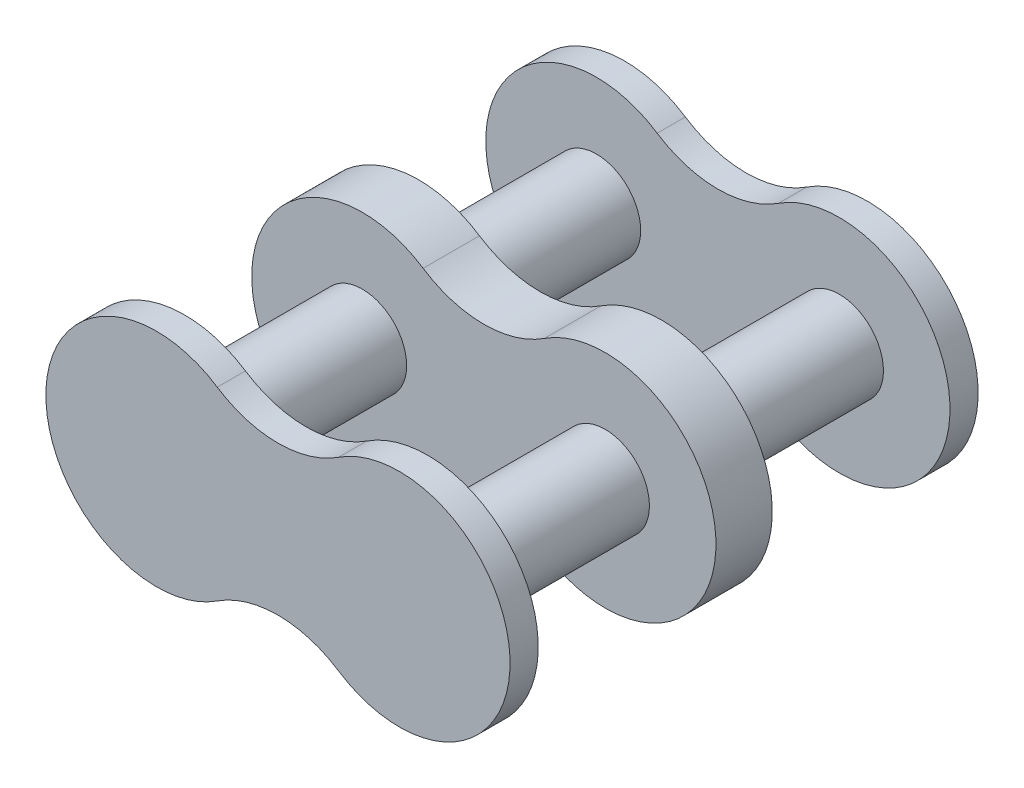
from build123d import *

# Parameters (mm, degrees)
BOSS_EXTRUDE1_DEPTH = 0.7366
BOSS_EXTRUDE2_START = 5.3848
BOSS_EXTRUDE2_DEPTH = 0.7366
SKETCH2_R           = 1.1557
BOSS_EXTRUDE3_DEPTH = 4.6482
BOSS_EXTRUDE4_START = -5.3848
BOSS_EXTRUDE4_DEPTH = 0.7366
BOSS_EXTRUDE5_START = -6.1214
SKETCH2_2_R         = 1.1557
BOSS_EXTRUDE5_DEPTH = 4.6482


with BuildPart() as part:
    # Sketch1 → Boss-Extrude1 (new, symmetric)
    with BuildSketch(Plane.XY):
        with BuildLine():
            ThreePointArc((-1.5875, 2.421640582), (-6.0706, 0), (-1.5875, -2.421640582))
            ThreePointArc((-1.5875, -2.421640582), (0, -1.947681165), (1.5875, -2.421640582))
            ThreePointArc((1.5875, -2.421640582), (6.0706, 0), (1.5875, 2.421640582))
            ThreePointArc((1.5875, 2.421640582), (0, 1.947681165), (-1.5875, 2.421640582))
        make_face()
    extrude(amount=BOSS_EXTRUDE1_DEPTH, both=True)



with BuildPart() as body_2:
    # Sketch1<2> → Boss-Extrude2 (new body)
    with BuildSketch(Plane.XY.offset(BOSS_EXTRUDE2_START)):
        with BuildLine():
            ThreePointArc((-1.5875, 2.421640582), (-6.0706, 0), (-1.5875, -2.421640582))
            ThreePointArc((-1.5875, -2.421640582), (0, -1.947681165), (1.5875, -2.421640582))
            ThreePointArc((1.5875, -2.421640582), (6.0706, 0), (1.5875, 2.421640582))
            ThreePointArc((1.5875, 2.421640582), (0, 1.947681165), (-1.5875, 2.421640582))
        make_face()
    extrude(amount=BOSS_EXTRUDE2_DEPTH)


with BuildPart() as part_1:
    add(part.part)

    add(body_2.part)  # Boss-Extrude3 merges body 2
    # Sketch2 → Boss-Extrude3 (add)
    with BuildSketch(Plane.XY.offset(0.7366)):
        with Locations((-3.175, 0)):
            Circle(SKETCH2_R)
        with Locations((3.175, 0)):
            Circle(SKETCH2_R)
    extrude(amount=BOSS_EXTRUDE3_DEPTH)



with BuildPart() as body_2_2:
    # Sketch1<3> → Boss-Extrude4 (new body)
    with BuildSketch(Plane.XY.offset(BOSS_EXTRUDE4_START)):
        with BuildLine():
            ThreePointArc((-1.5875, 2.421640582), (-6.0706, 0), (-1.5875, -2.421640582))
            ThreePointArc((-1.5875, -2.421640582), (0, -1.947681165), (1.5875, -2.421640582))
            ThreePointArc((1.5875, -2.421640582), (6.0706, 0), (1.5875, 2.421640582))
            ThreePointArc((1.5875, 2.421640582), (0, 1.947681165), (-1.5875, 2.421640582))
        make_face()
    extrude(amount=-BOSS_EXTRUDE4_DEPTH)


with BuildPart() as part_2:
    add(part_1.part)

    add(body_2_2.part)  # Boss-Extrude5 merges body 2 2
    # Sketch2<2> → Boss-Extrude5 (add)
    with BuildSketch(Plane.XY.offset(0.7366).offset(BOSS_EXTRUDE5_START)):
        with Locations((-3.175, 0)):
            Circle(SKETCH2_2_R)
        with Locations((3.175, 0)):
            Circle(SKETCH2_2_R)
    extrude(amount=BOSS_EXTRUDE5_DEPTH)


solid = part_2.part
